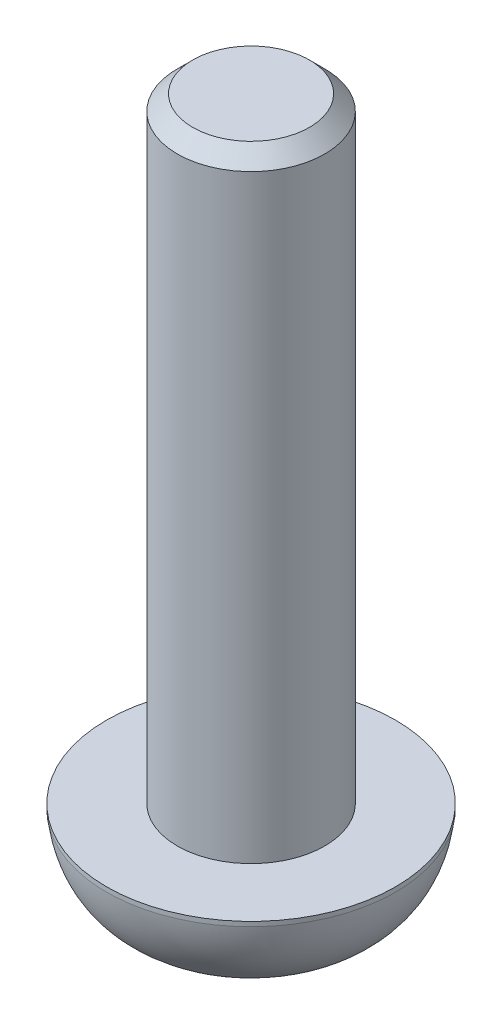
from build123d import *

# Parameters (mm, degrees)
SKETCH1_R           = 4.7
BOSS_EXTRUDE1_DEPTH = 3
SKETCH2_R           = 2.4
BOSS_EXTRUDE2_DEPTH = 20
CUT_EXTRUDE1_DEPTH  = 1.5
CHAMFER1_SIZE       = 0.5


with BuildPart() as part:
    # Sketch1 → Boss-Extrude1 (new body)
    with BuildSketch(Plane(origin=(0, 0, 0), x_dir=(1, 0, 0), z_dir=(0, 1, 0))):
        with Locations(Location((0, 0, 0), (0, 0, 270))):
            Circle(SKETCH1_R)
    extrude(amount=BOSS_EXTRUDE1_DEPTH)

    # Sketch2 → Boss-Extrude2 (add)
    with BuildSketch(Plane(origin=(0, 3, 0), x_dir=(1, 0, 0), z_dir=(0, 1, 0))):
        with Locations(Location((0, 0, 0), (0, 0, 270))):
            Circle(SKETCH2_R)
    extrude(amount=BOSS_EXTRUDE2_DEPTH)

    # Sketch3 → Cut-Revolve1 (revolve, cut)
    with BuildSketch(Plane.XY, mode=Mode.PRIVATE) as cut_revolve1_sk:
        with BuildLine():
            Line((2.35, 0), (4.7, 0))
            Line((4.7, 0), (4.7, 2.85))
            add(Edge.make_bspline(
                [(2.35, 0), (4.432462228, 0.599611143), (4.7, 2.85)],
                knots=[0, 0, 0, 1, 1, 1], degree=2))
        make_face()
    revolve(cut_revolve1_sk.sketch.rotate(Axis((0, 0, 0), (0, 1, 0)), 90), axis=Axis((0, 0, 0), (0, 1, 0)), mode=Mode.SUBTRACT)

    # Sketch4 → Cut-Extrude1 (cut)
    with BuildSketch(Plane.XZ):
        Polygon((0, 1.732050808), (-1.5, 0.866025404), (-1.5, -0.866025404), (0, -1.732050808), (1.5, -0.866025404), (1.5, 0.866025404), align=None)
    extrude(amount=-CUT_EXTRUDE1_DEPTH, mode=Mode.SUBTRACT)

    # Chamfer1
    chamfer1_edges = [part.edges().sort_by_distance(p)[0] for p in [
        (0, 23, -2.4),
    ]]
    chamfer(chamfer1_edges, length=CHAMFER1_SIZE)


solid = part.part
